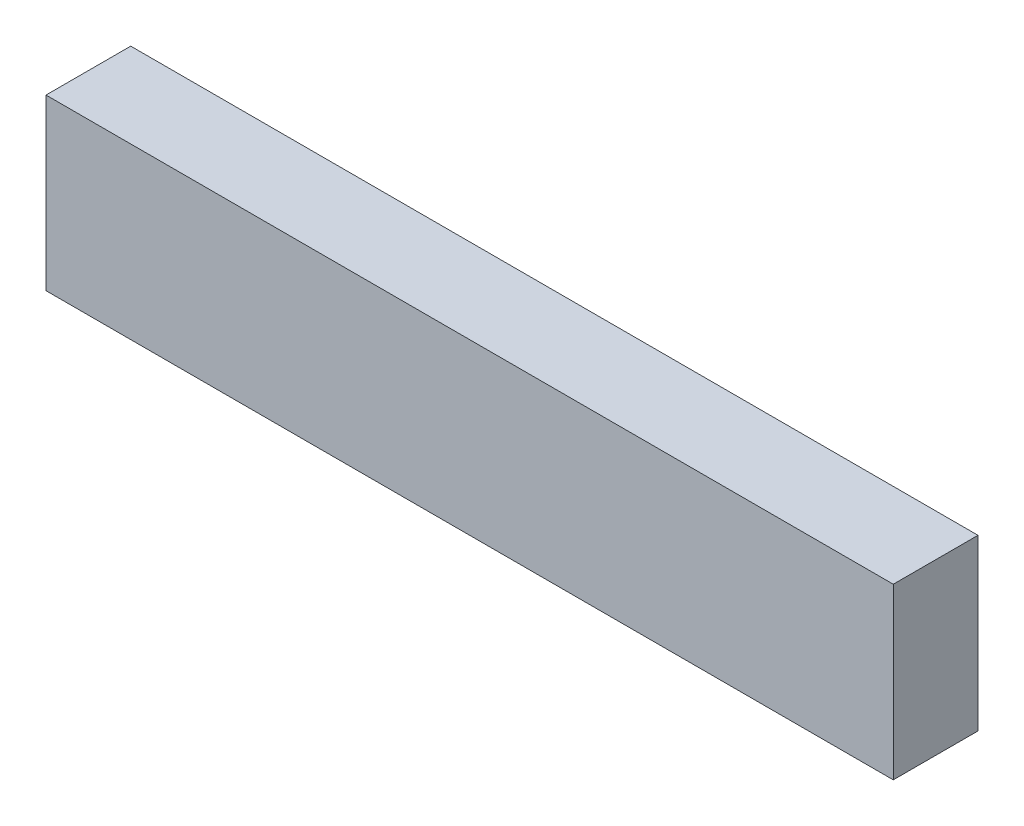
from build123d import *

# Parameters (mm, degrees)
SKETCH_2_W      = 10
SKETCH_2_H      = 20
EXTRUDE_1_DEPTH = 100


with BuildPart() as part:
    # Эскиз2 → Бобышка-Вытянуть1 (new body)
    with BuildSketch(Plane(origin=(0, 0, 0), x_dir=(0, 0, -1), z_dir=(1, 0, 0))):
        Rectangle(SKETCH_2_W, SKETCH_2_H)
    extrude(amount=EXTRUDE_1_DEPTH)


solid = part.part
